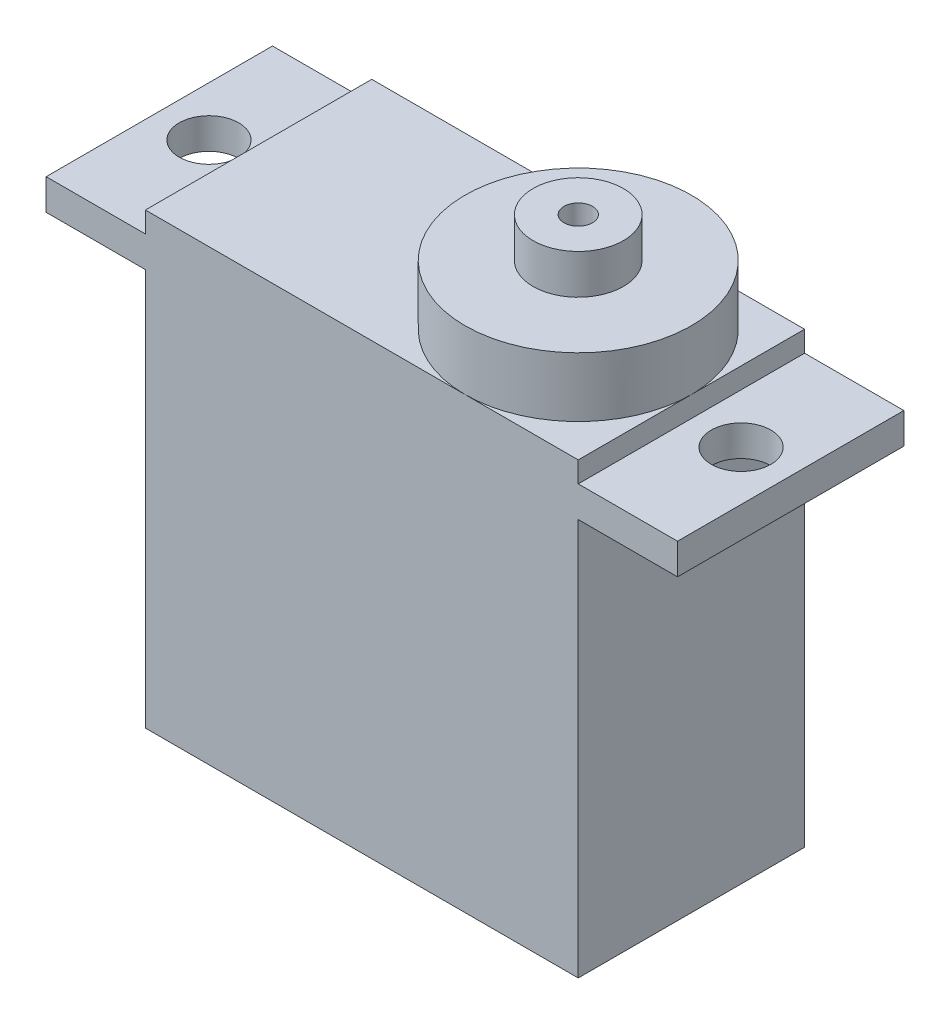
from build123d import *

# Parameters (mm, degrees)
SKETCH1_W           = 21.8
SKETCH1_H           = 22.6
BOSS_EXTRUDE1_DEPTH = 11.4
SKETCH2_W           = 31.8
SKETCH2_H           = 1.555593414
BOSS_EXTRUDE2_DEPTH = 11.4
SKETCH3_R           = 5.7
BOSS_EXTRUDE3_DEPTH = 3
SKETCH4_R           = 2.275
BOSS_EXTRUDE4_DEPTH = 2
SKETCH5_R           = 0.717779634
CUT_EXTRUDE1_DEPTH  = 2.4
SKETCH7_R           = 1.5
CUT_EXTRUDE2_DEPTH  = 10


with BuildPart() as part:
    # Sketch1 → Boss-Extrude1 (new body)
    with BuildSketch(Plane.XY):
        Rectangle(SKETCH1_W, SKETCH1_H)
    extrude(amount=BOSS_EXTRUDE1_DEPTH)

    # Sketch2 → Boss-Extrude2 (add)
    with BuildSketch(Plane.XY.offset(11.4)):
        with Locations((0, 9.475117961)):
            Rectangle(SKETCH2_W, SKETCH2_H)
    extrude(amount=-BOSS_EXTRUDE2_DEPTH)

    # Sketch3 → Boss-Extrude3 (add)
    with BuildSketch(Plane(origin=(0, 11.3, 0), x_dir=(1, 0, 0), z_dir=(0, 1, 0))):
        with Locations(Location((5.2, -5.7, 0), (0, 0, 270))):
            Circle(SKETCH3_R)
    extrude(amount=BOSS_EXTRUDE3_DEPTH)

    # Sketch4 → Boss-Extrude4 (add)
    with BuildSketch(Plane(origin=(0, 14.3, 0), x_dir=(1, 0, 0), z_dir=(0, 1, 0))):
        with Locations(Location((5.2, -5.7, 0), (0, 0, 270))):
            Circle(SKETCH4_R)
    extrude(amount=BOSS_EXTRUDE4_DEPTH)

    # Sketch5 → Cut-Extrude1 (cut)
    with BuildSketch(Plane(origin=(0, 16.3, 0), x_dir=(1, 0, 0), z_dir=(0, 1, 0))):
        with Locations(Location((5.2, -5.7, 0), (0, 0, 270))):
            Circle(SKETCH5_R)
    extrude(amount=-CUT_EXTRUDE1_DEPTH, mode=Mode.SUBTRACT)

    # Sketch7 → Cut-Extrude2 (cut)
    with BuildSketch(Plane(origin=(0, 10.252914668, 0), x_dir=(1, 0, 0), z_dir=(0, 1, 0))):
        with Locations(Location((13.399999972, -5.699036205, 0), (0, 0, 270))):
            Circle(SKETCH7_R)
        with Locations(Location((-13.4, -5.7, 0), (0, 0, 270))):
            Circle(SKETCH7_R)
    extrude(amount=-CUT_EXTRUDE2_DEPTH, mode=Mode.SUBTRACT)


solid = part.part
